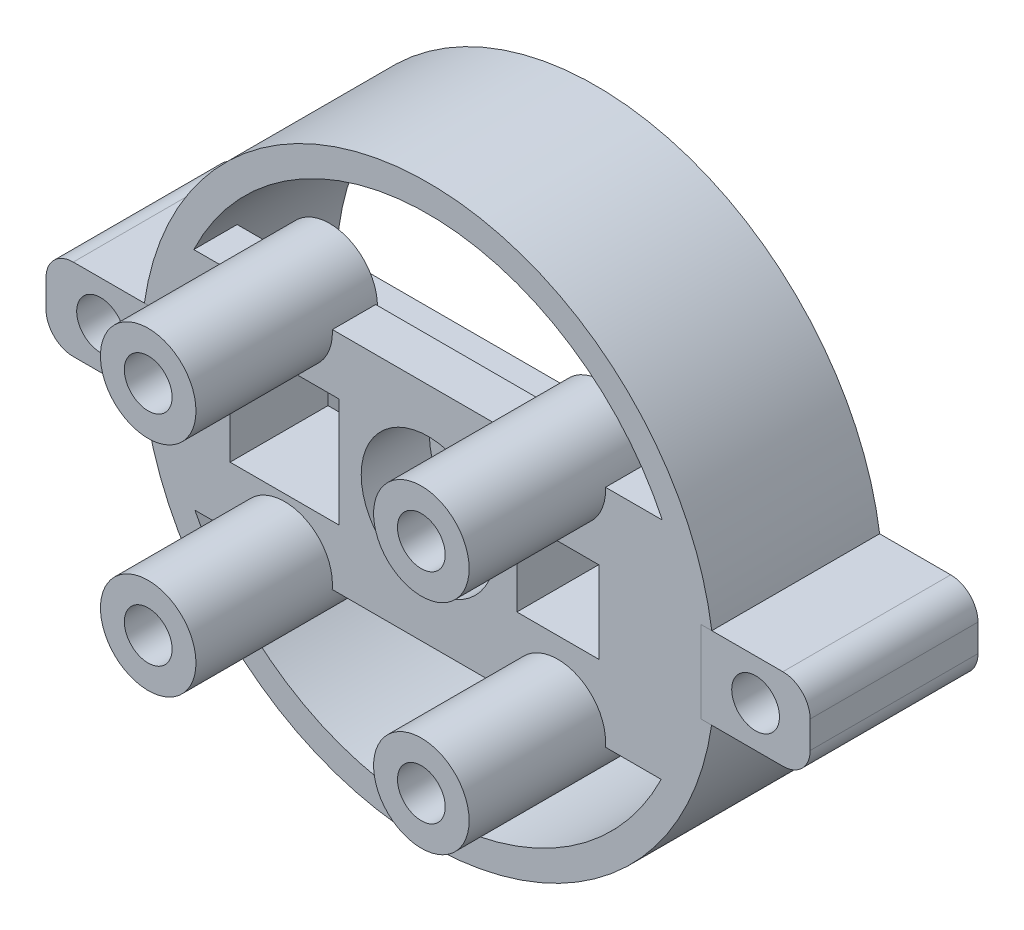
from build123d import *

# Parameters (mm, degrees)
SKETCH1_R               = 21
SKETCH1_R_2             = 19.01
BOSS_EXTRUDE1_DEPTH     = 12.3
BOSS_EXTRUDE3_START     = -3.175
SKETCH4_W               = 16.5
SKETCH4_H               = 16.5
BOSS_EXTRUDE3_DEPTH     = 3.175
SKETCH8_W               = 29.000689647
SKETCH8_H               = 11.495244731
SKETCH8_R               = 2.59
BOSS_EXTRUDE4_DEPTH     = 4
CUT_EXTRUDE2_DEPTH      = 33.144828511
CUT_EXTRUDE2_DEPTH_BACK = 5
SKETCH7_R               = 4.9
SKETCH11_W              = 6
SKETCH11_H              = 6
SKETCH11_W_2            = 8
SKETCH11_H_2            = 8
CUT_EXTRUDE21_DEPTH     = 29
BOSS_EXTRUDE5_START     = -12.3
SKETCH12_W              = 8
SKETCH12_H              = 6
SKETCH12_R              = 1.75
BOSS_EXTRUDE5_DEPTH     = 12.3001
FILLET1_R               = 2
BOSS_EXTRUDE6_START     = -3.3
SKETCH13_R              = 3.5
BOSS_EXTRUDE6_DEPTH     = 13.3
SKETCH14_R              = 1.75
CUT_EXTRUDE22_DEPTH     = 20.3
CUT_EXTRUDE24_REACH     = 43.5
SKETCH15_R              = 1.75


with BuildPart() as part:
    # Sketch1 → Boss-Extrude1 (new body)
    with BuildSketch(Plane.XY):
        Circle(SKETCH1_R)
        Circle(SKETCH1_R_2, mode=Mode.SUBTRACT)
    extrude(amount=BOSS_EXTRUDE1_DEPTH)

    # Sketch4 → Boss-Extrude3 (add)
    with BuildSketch(Plane.XY.offset(12.3).offset(BOSS_EXTRUDE3_START)):
        with BuildLine():
            ThreePointArc((19.01, 0), (18.543691139, 4.184688632), (17.167641352, 8.164079275))
            Line((17.167641352, 8.164079275), (8.267129889, 8.164079275))
            Line((8.267129889, 8.164079275), (8.267129889, -8.335920725))
            Line((8.267129889, -8.335920725), (17.084862471, -8.335920725))
            ThreePointArc((17.084862471, -8.335920725), (18.522463869, -4.277666678), (19.01, 0))
        make_face()
        with Locations((0.017129889, -0.085920725)):
            Rectangle(SKETCH4_W, SKETCH4_H)
        with BuildLine():
            Line((-8.232870111, 8.164079275), (-17.167641352, 8.164079275))
            ThreePointArc((-17.167641352, 8.164079275), (-19.00976077, -0.095370104), (-17.084862471, -8.335920725))
            Line((-17.084862471, -8.335920725), (-8.232870111, -8.335920725))
            Line((-8.232870111, -8.335920725), (-8.232870111, 8.164079275))
        make_face()
    extrude(amount=BOSS_EXTRUDE3_DEPTH)

    # Sketch8 → Boss-Extrude4 (add)
    with BuildSketch(Plane.XY.offset(9.125)):
        with Locations((-0.119782029, 0.187903113)):
            Rectangle(SKETCH8_W, SKETCH8_H)
        with Locations((-0.11978203, 0.187903113)):
            Circle(SKETCH8_R, mode=Mode.SUBTRACT)
    extrude(amount=-BOSS_EXTRUDE4_DEPTH)

    # Sketch7 → Cut-Extrude2 (cut, two sides: drawn at the far end of the back side and taken through both)
    with BuildSketch(Plane.XY.offset(12.3).offset(-CUT_EXTRUDE2_DEPTH_BACK)):
        with Locations(Location((0, 0, 0), (0, 0, 180))):
            Circle(SKETCH7_R)
    extrude(amount=CUT_EXTRUDE2_DEPTH + CUT_EXTRUDE2_DEPTH_BACK, mode=Mode.SUBTRACT)

    # Sketch11 → Cut-Extrude21 (cut)
    with BuildSketch(Plane(origin=(0, 0, 12.3), x_dir=(-1, 0, 0), z_dir=(0, 0, -1))):
        with Locations((-9.507481694, 0)):
            Rectangle(SKETCH11_W, SKETCH11_H)
        with Locations((10.51, 0)):
            Rectangle(SKETCH11_W_2, SKETCH11_H_2)
    extrude(amount=CUT_EXTRUDE21_DEPTH, mode=Mode.SUBTRACT)

    # Sketch12 → Boss-Extrude5 (add)
    with BuildSketch(Plane.XY.offset(12.3).offset(BOSS_EXTRUDE5_START)):
        with Locations((-24, -0.044603744)):
            Rectangle(SKETCH12_W, SKETCH12_H)
        with Locations((-24, -0.044603744)):
            Circle(SKETCH12_R, mode=Mode.SUBTRACT)
    boss_extrude5 = extrude(amount=BOSS_EXTRUDE5_DEPTH)

    # Mirror3: Boss-Extrude5 across plane
    add(boss_extrude5.mirror(Plane(origin=(0, 0, 0), x_dir=(0, 0, 1), z_dir=(1, 0, 0))))

    # Fillet1
    fillet1_edges = [part.edges().sort_by_distance(p)[0] for p in [
        (-28, -3.044603744, 6.15005),
        (-28, 2.955396256, 6.15005),
        (28, -3.044603744, 6.15005),
        (28, 2.955396256, 6.15005),
    ]]
    fillet(fillet1_edges, radius=FILLET1_R)

    # Sketch13 → Boss-Extrude6 (add)
    with BuildSketch(Plane.XY.offset(12.3).offset(BOSS_EXTRUDE6_START)):
        with Locations((-10.51, -8)):
            Circle(SKETCH13_R)
        with Locations((9.507481694, -8)):
            Circle(SKETCH13_R)
    boss_extrude6 = extrude(amount=BOSS_EXTRUDE6_DEPTH)

    # Sketch14 → Cut-Extrude22 (cut)
    with BuildSketch(Plane.XY.offset(22.3)):
        with Locations((-10.51, -8)):
            Circle(SKETCH14_R)
    cut_extrude22 = extrude(amount=-CUT_EXTRUDE22_DEPTH, mode=Mode.SUBTRACT)

    # Sketch15 → Cut-Extrude24 (cut, up to next)
    with BuildSketch(Plane.XY.offset(22.3), mode=Mode.PRIVATE) as cut_extrude24_sk1:
        with Locations((9.507481694, -8)):
            Circle(SKETCH15_R)
    cut_extrude24_tool1 = extrude(cut_extrude24_sk1.sketch, amount=-CUT_EXTRUDE24_REACH, mode=Mode.PRIVATE) & part.part
    cut_extrude24 = cut_extrude24_tool1.solids().sort_by_distance((9.507482, -8, 22.3))[0]
    add(cut_extrude24, mode=Mode.SUBTRACT)

    # Mirror5: Boss-Extrude6, Cut-Extrude22, Cut-Extrude24 across plane
    add(boss_extrude6.mirror(Plane.ZX))
    add(cut_extrude22.mirror(Plane.ZX), mode=Mode.SUBTRACT)
    add(cut_extrude24.mirror(Plane.ZX), mode=Mode.SUBTRACT)


solid = part.part
